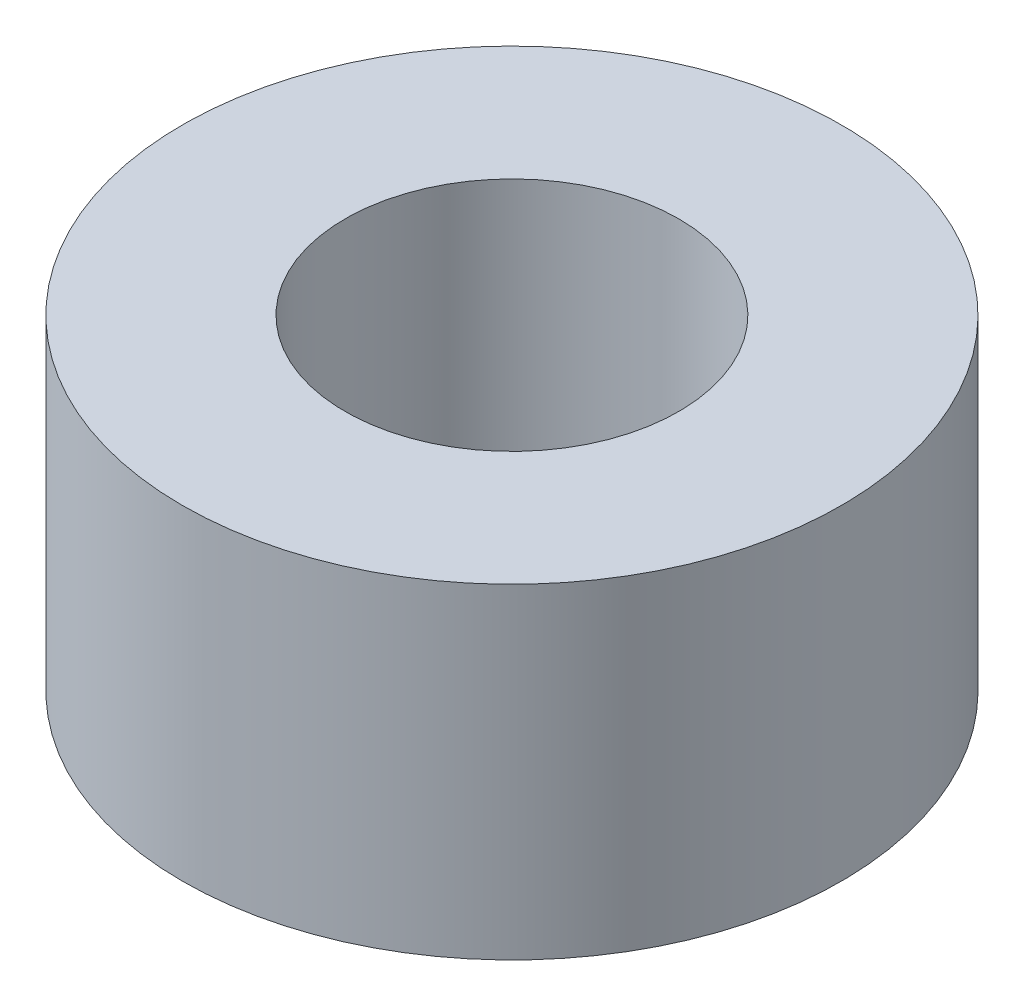
from build123d import *

# Parameters (mm, degrees)
SKIZZE2_R                       = 3.95
AUFSATZ_LINEAR_AUSTRAGEN1_DEPTH = 3.9
SKIZZE3_R                       = 2
SCHNITT_LINEAR_AUSTRAGEN1_DEPTH = 3.9


with BuildPart() as part:
    # Skizze2 → Aufsatz-Linear austragen1 (new body)
    with BuildSketch(Plane(origin=(0, 0, 0), x_dir=(1, 0, 0), z_dir=(0, 1, 0))):
        with Locations(Location((0, 0, 0), (0, 0, 270))):
            Circle(SKIZZE2_R)
    extrude(amount=AUFSATZ_LINEAR_AUSTRAGEN1_DEPTH)

    # Skizze3 → Schnitt-Linear austragen1 (cut)
    with BuildSketch(Plane.XZ):
        with Locations(Location((0, 0, 0), (0, 0, 270))):
            Circle(SKIZZE3_R)
    extrude(amount=-SCHNITT_LINEAR_AUSTRAGEN1_DEPTH, mode=Mode.SUBTRACT)


solid = part.part
